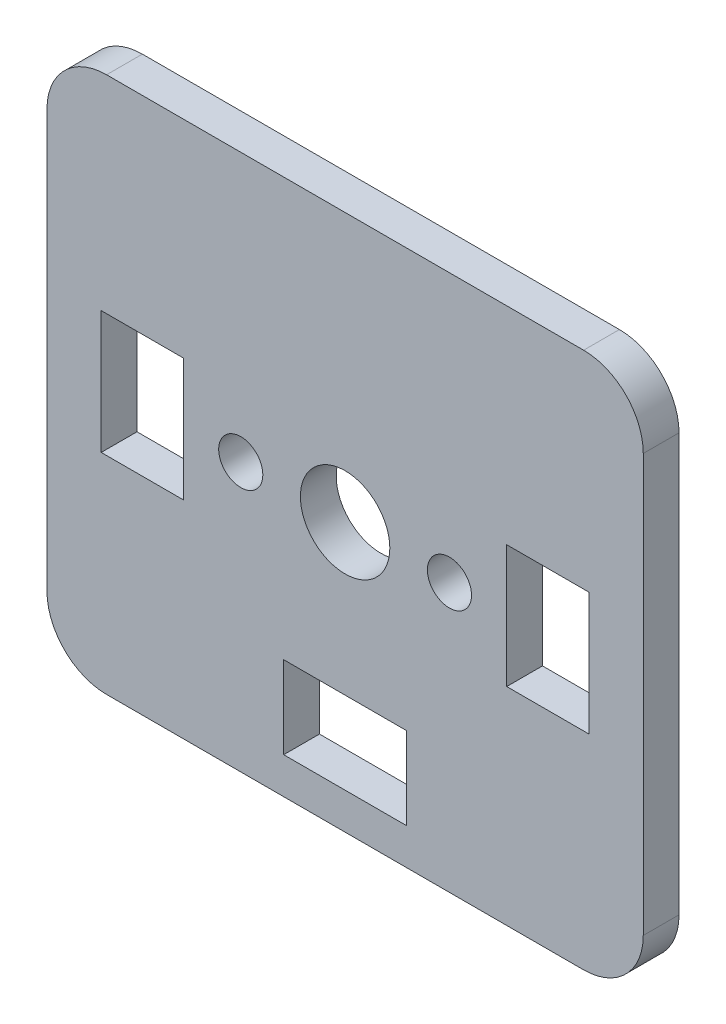
from build123d import *

# Parameters (mm, degrees)
SKETCH1_W           = 50
SKETCH1_H           = 45
SKETCH1_R           = 3.75
SKETCH1_R_2         = 1.85
SKETCH1_W_2         = 6.9
SKETCH1_H_2         = 10.3
SKETCH1_W_3         = 10.3
SKETCH1_H_3         = 6.9
BOSS_EXTRUDE1_DEPTH = 3
FILLET1_R           = 5


with BuildPart() as part:
    # Sketch1 → Boss-Extrude1 (new body)
    with BuildSketch(Plane.XY):
        Rectangle(SKETCH1_W, SKETCH1_H)
        Circle(SKETCH1_R, mode=Mode.SUBTRACT)
        with Locations((8.75, 0)):
            Circle(SKETCH1_R_2, mode=Mode.SUBTRACT)
        with Locations((-8.75, 0)):
            Circle(SKETCH1_R_2, mode=Mode.SUBTRACT)
        with Locations((17, 0)):
            Rectangle(SKETCH1_W_2, SKETCH1_H_2, mode=Mode.SUBTRACT)
        with Locations((-17, 0)):
            Rectangle(SKETCH1_W_2, SKETCH1_H_2, mode=Mode.SUBTRACT)
        with Locations((0, -16)):
            Rectangle(SKETCH1_W_3, SKETCH1_H_3, mode=Mode.SUBTRACT)
    extrude(amount=BOSS_EXTRUDE1_DEPTH)

    # Fillet1
    fillet1_edges = [part.edges().sort_by_distance(p)[0] for p in [
        (25, -22.5, 1.5),
        (-25, -22.5, 1.5),
        (-25, 22.5, 1.5),
        (25, 22.5, 1.5),
    ]]
    fillet(fillet1_edges, radius=FILLET1_R)


solid = part.part
